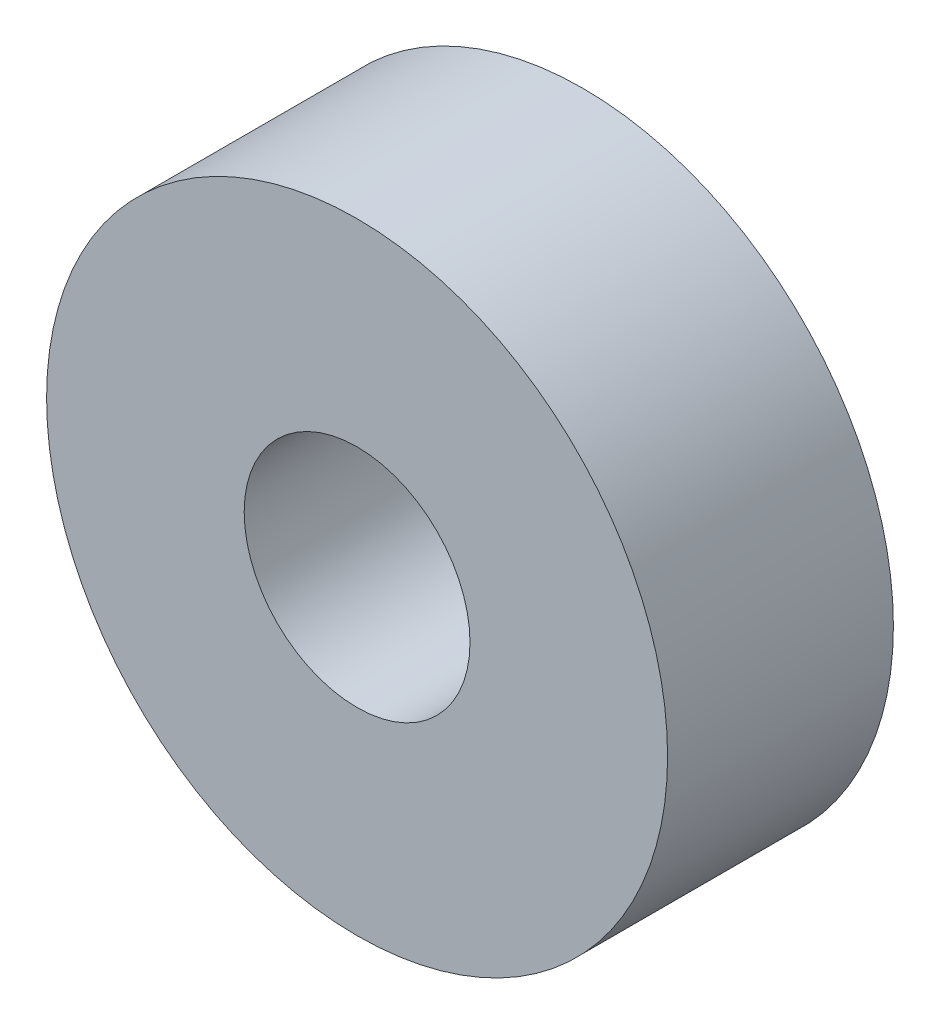
from build123d import *

# Parameters (mm, degrees)
SKETCH1_W = 7
SKETCH1_H = 8


with BuildPart() as part:
    # Sketch1 → Revolve1 (revolve)
    with BuildSketch(Plane.XZ, mode=Mode.PRIVATE) as revolve1_sk:
        with Locations((7.5, 4)):
            Rectangle(SKETCH1_W, SKETCH1_H)
    revolve(revolve1_sk.sketch.rotate(Axis((0, 0, 8), (0, 0, -1)), 180), axis=Axis((0, 0, 8), (0, 0, -1)))


solid = part.part
